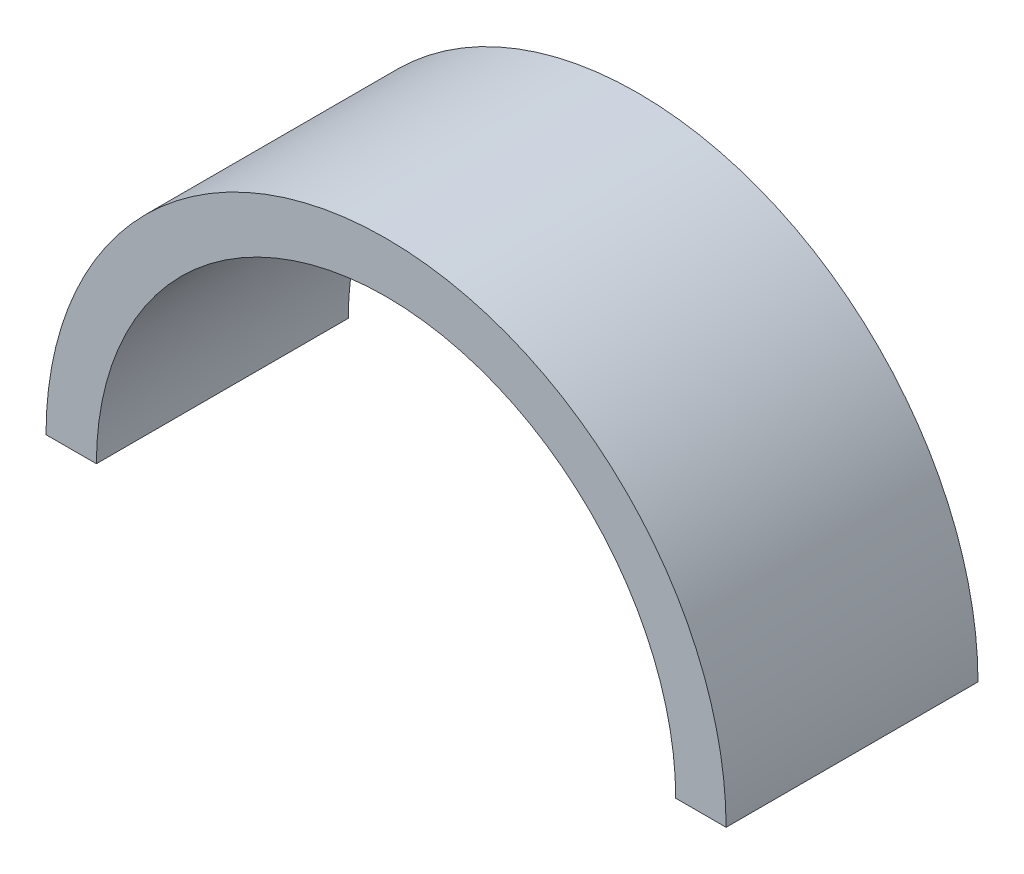
from build123d import *

# Parameters (mm, degrees)
PROFILE_DEPTH = 20


with BuildPart() as part:
    # Sketch1 → Profile (new body)
    with BuildSketch(Plane.XY):
        with BuildLine():
            Line((54, 27), (50, 27))
            ThreePointArc((50, 27), (27, 50), (4, 27))
            Line((4, 27), (0, 27))
            ThreePointArc((0, 27), (27, 54), (54, 27))
        make_face()
    extrude(amount=PROFILE_DEPTH)


solid = part.part
